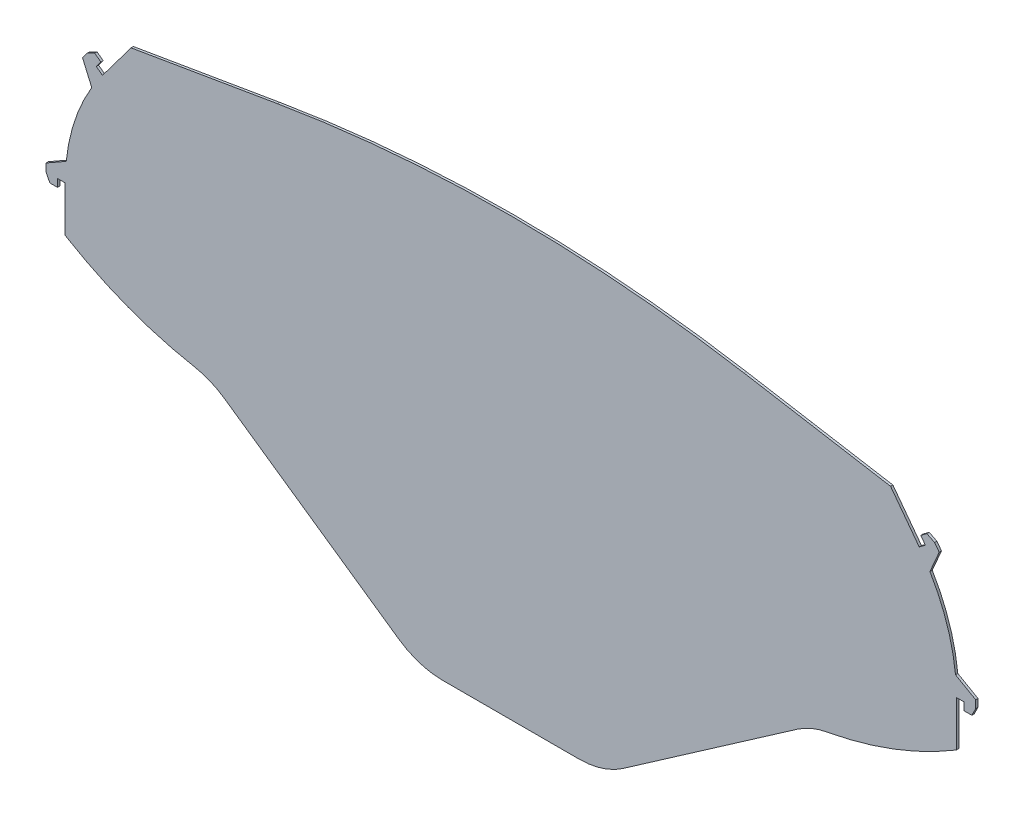
from build123d import *

# Parameters (mm, degrees)
MAIN_SHAPE_DEPTH        = 0.6
TABS_DEPTH              = 154.060061459
TABS_DEPTH_BACK         = 154.060061459
CHIN_GUARD_DEPTH        = 0.6
FILLET1_R               = 20
CUT_EXTRUDE1_DEPTH      = 172.662513141
CUT_EXTRUDE1_DEPTH_BACK = 172.662513141


with BuildPart() as part:
    # Sketch1 → Main Shape (new body)
    with BuildSketch(Plane.XY):
        with BuildLine():
            Line((-24, -91.764766734), (24, -91.764766734))
            Line((24, -91.764766734), (78.266232563, -84.05670244))
            ThreePointArc((78.266232563, -84.05670244), (97.655491519, -79.289252293), (115.711102551, -70.764766734))
            ThreePointArc((115.711102551, -70.764766734), (120.685143325, -65.658407438), (122.5, -58.764766734))
            ThreePointArc((122.5, -58.764766734), (120.227482046, -43.118277124), (113.597722286, -28.764766734))
            ThreePointArc((113.597722286, -28.764766734), (107.811505455, -22.955172168), (100.180351554, -19.955641477))
            Line((100.180351554, -19.955641477), (60.74391922, -13.264766734))
            ThreePointArc((60.74391922, -13.264766734), (50.804108255, -9.246591688), (43.461443341, -1.434367632))
            ThreePointArc((43.461443341, -1.434367632), (36.448172688, 5.805997675), (26.941855461, 9.15842781))
            Line((26.941855461, 9.15842781), (17, 10.235233266))
            Line((17, 10.235233266), (10, 0))
            Line((10, 0), (-10, 0))
            Line((-10, 0), (-17, 10.235233266))
            Line((-17, 10.235233266), (-26.941855461, 9.15842781))
            ThreePointArc((-26.941855461, 9.15842781), (-36.448172688, 5.805997675), (-43.461443341, -1.434367632))
            ThreePointArc((-43.461443341, -1.434367632), (-50.804108255, -9.246591688), (-60.74391922, -13.264766734))
            Line((-60.74391922, -13.264766734), (-100.180351554, -19.955641477))
            ThreePointArc((-100.180351554, -19.955641477), (-107.811505455, -22.955172168), (-113.597722286, -28.764766734))
            ThreePointArc((-113.597722286, -28.764766734), (-120.227482046, -43.118277124), (-122.5, -58.764766734))
            ThreePointArc((-122.5, -58.764766734), (-120.685143325, -65.658407438), (-115.711102551, -70.764766734))
            ThreePointArc((-115.711102551, -70.764766734), (-97.655491519, -79.289252293), (-78.266232563, -84.05670244))
            Line((-78.266232563, -84.05670244), (-24, -91.764766734))
        make_face()
    extrude(amount=MAIN_SHAPE_DEPTH)

    # Sketch2 → Tabs (cut, two sides: drawn at the far end of the back side and taken through both)
    with BuildSketch(Plane.XY.offset(0.6).offset(-TABS_DEPTH_BACK)):
        with BuildLine():
            Line((-121, -58.764766734), (-121, -56.764766734))
            Line((-121, -56.764766734), (-115.742268041, -53.771413729))
            ThreePointArc((-115.742268041, -53.771413729), (-113.511139955, -43.427720083), (-109.089826236, -33.814088314))
            Line((-109.089826236, -33.814088314), (-111.5, -28.264766734))
            Line((-111.5, -28.264766734), (-110.3, -26.664766734))
            Line((-110.3, -26.664766734), (-108.3, -25.664766734))
            Line((-108.3, -25.664766734), (-106.7, -26.864766734))
            Line((-106.7, -26.864766734), (-107.9, -28.464766734))
            Line((-107.9, -28.464766734), (-106.3, -29.664766734))
            Line((-106.3, -29.664766734), (-98.84870892, -19.729711961))
            Line((-98.84870892, -19.729711961), (-100.180351554, -19.955641477))
            ThreePointArc((-100.180351554, -19.955641477), (-107.811505455, -22.955172168), (-113.597722286, -28.764766734))
            ThreePointArc((-113.597722286, -28.764766734), (-120.227482046, -43.118277124), (-122.5, -58.764766734))
            ThreePointArc((-122.5, -58.764766734), (-120.767844146, -65.510135516), (-116, -70.586357152))
            Line((-116, -70.586357152), (-116, -58.764766734))
            Line((-116, -58.764766734), (-118, -58.764766734))
            Line((-118, -58.764766734), (-118, -60.764766734))
            Line((-118, -60.764766734), (-120, -60.764766734))
            Line((-120, -60.764766734), (-121, -58.764766734))
        make_face()
        with BuildLine():
            Line((110.3, -26.664766734), (111.5, -28.264766734))
            Line((111.5, -28.264766734), (109.089826236, -33.814088314))
            ThreePointArc((109.089826236, -33.814088314), (113.511139955, -43.427720083), (115.742268041, -53.771413729))
            Line((115.742268041, -53.771413729), (121, -56.764766734))
            Line((121, -56.764766734), (121, -58.764766734))
            Line((121, -58.764766734), (120, -60.764766734))
            Line((120, -60.764766734), (118, -60.764766734))
            Line((118, -60.764766734), (118, -58.764766734))
            Line((118, -58.764766734), (116, -58.764766734))
            Line((116, -58.764766734), (116, -70.586357152))
            ThreePointArc((116, -70.586357152), (120.767844146, -65.510135516), (122.5, -58.764766734))
            ThreePointArc((122.5, -58.764766734), (120.227482046, -43.118277124), (113.597722286, -28.764766734))
            ThreePointArc((113.597722286, -28.764766734), (107.811505455, -22.955172168), (100.180351554, -19.955641477))
            Line((100.180351554, -19.955641477), (98.84870892, -19.729711961))
            Line((98.84870892, -19.729711961), (106.3, -29.664766734))
            Line((106.3, -29.664766734), (107.9, -28.464766734))
            Line((107.9, -28.464766734), (106.7, -26.864766734))
            Line((106.7, -26.864766734), (108.3, -25.664766734))
            Line((108.3, -25.664766734), (110.3, -26.664766734))
        make_face()
    extrude(amount=TABS_DEPTH + TABS_DEPTH_BACK, mode=Mode.SUBTRACT)

    # Sketch5 → Chin guard (add)
    with BuildSketch(Plane.XY.offset(0.6)):
        Polygon((-78.266232563, -84.05670244), (-24, -121.764766734), (24, -121.764766734), (78.266232563, -84.05670244), (24, -91.764766734), (-24, -91.764766734), align=None)
    extrude(amount=-CHIN_GUARD_DEPTH)

    # Fillet1
    fillet1_edges = [part.edges().sort_by_distance(p)[0] for p in [
        (-24, -121.764766734, 0.3),
        (24, -121.764766734, 0.3),
        (78.266232563, -84.05670244, 0.3),
        (-78.266232563, -84.05670244, 0.3),
    ]]
    fillet(fillet1_edges, radius=FILLET1_R)

    # Sketch6 → Cut-Extrude1 (cut, two sides: drawn at the far end of the back side and taken through both)
    with BuildSketch(Plane.XY.offset(0.6).offset(-CUT_EXTRUDE1_DEPTH_BACK)):
        with BuildLine():
            Line((-60.74391922, -13.264766734), (-60.74391922, 16.735233266))
            Line((-60.74391922, 16.735233266), (60.74391922, 16.735233266))
            Line((60.74391922, 16.735233266), (60.74391922, -13.264766734))
            ThreePointArc((60.74391922, -13.264766734), (0, -8.148349205), (-60.74391922, -13.264766734))
        make_face()
    extrude(amount=CUT_EXTRUDE1_DEPTH + CUT_EXTRUDE1_DEPTH_BACK, mode=Mode.SUBTRACT)


solid = part.part
